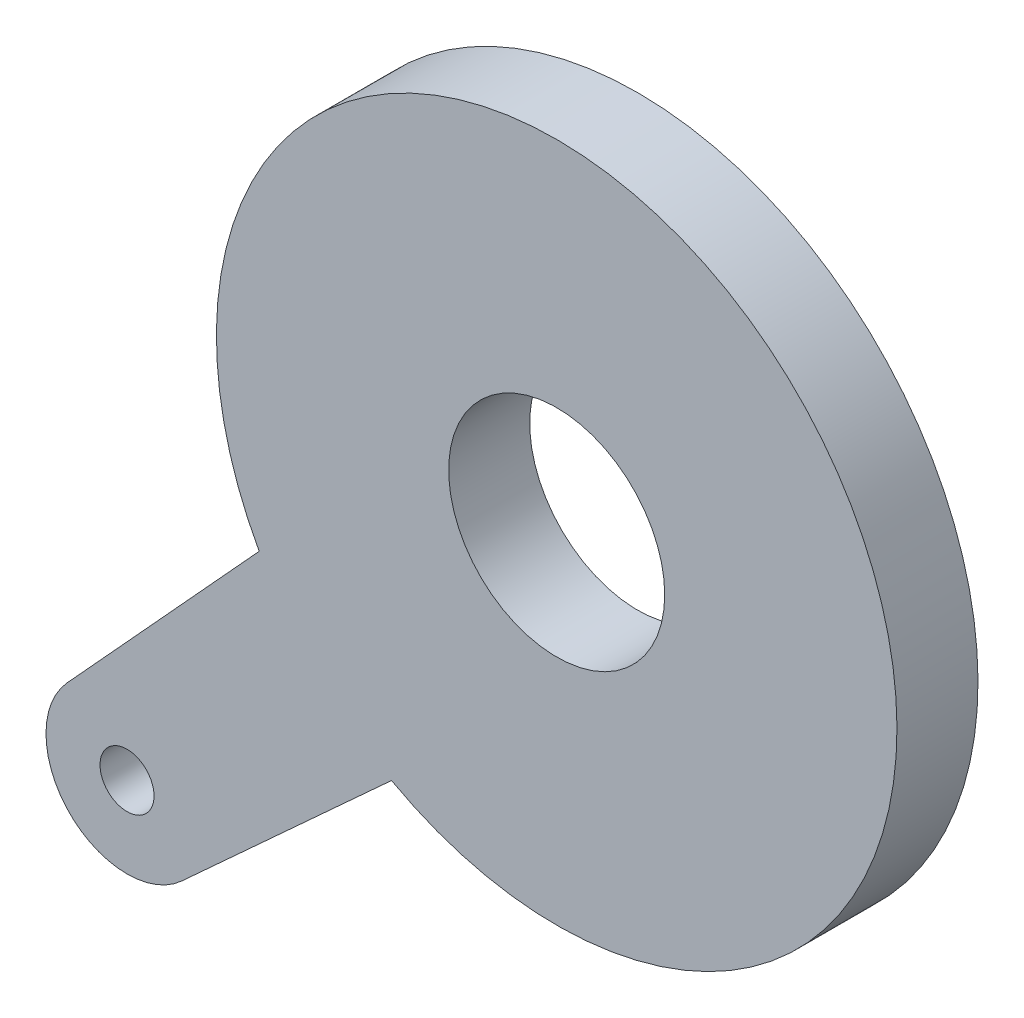
from build123d import *

# Parameters (mm, degrees)
SKETCH1_R           = 4
SKETCH1_R_2         = 1
BOSS_EXTRUDE1_DEPTH = 3


with BuildPart() as part:
    # Sketch1 → Boss-Extrude1 (new body)
    with BuildSketch(Plane.XY):
        with BuildLine():
            Line((-11.016163774, -6.115892061), (-18.123407658, -13.884959304))
            ThreePointArc((-18.123407658, -13.884959304), (-18.03122292, -18.03122292), (-13.884959304, -18.123407658))
            Line((-13.884959304, -18.123407658), (-6.115892061, -11.016163774))
            ThreePointArc((-6.115892061, -11.016163774), (8.909545443, 8.909545443), (-11.016163774, -6.115892061))
        make_face()
        Circle(SKETCH1_R, mode=Mode.SUBTRACT)
        with Locations((-15.909902577, -15.909902577)):
            Circle(SKETCH1_R_2, mode=Mode.SUBTRACT)
    extrude(amount=BOSS_EXTRUDE1_DEPTH)


solid = part.part
